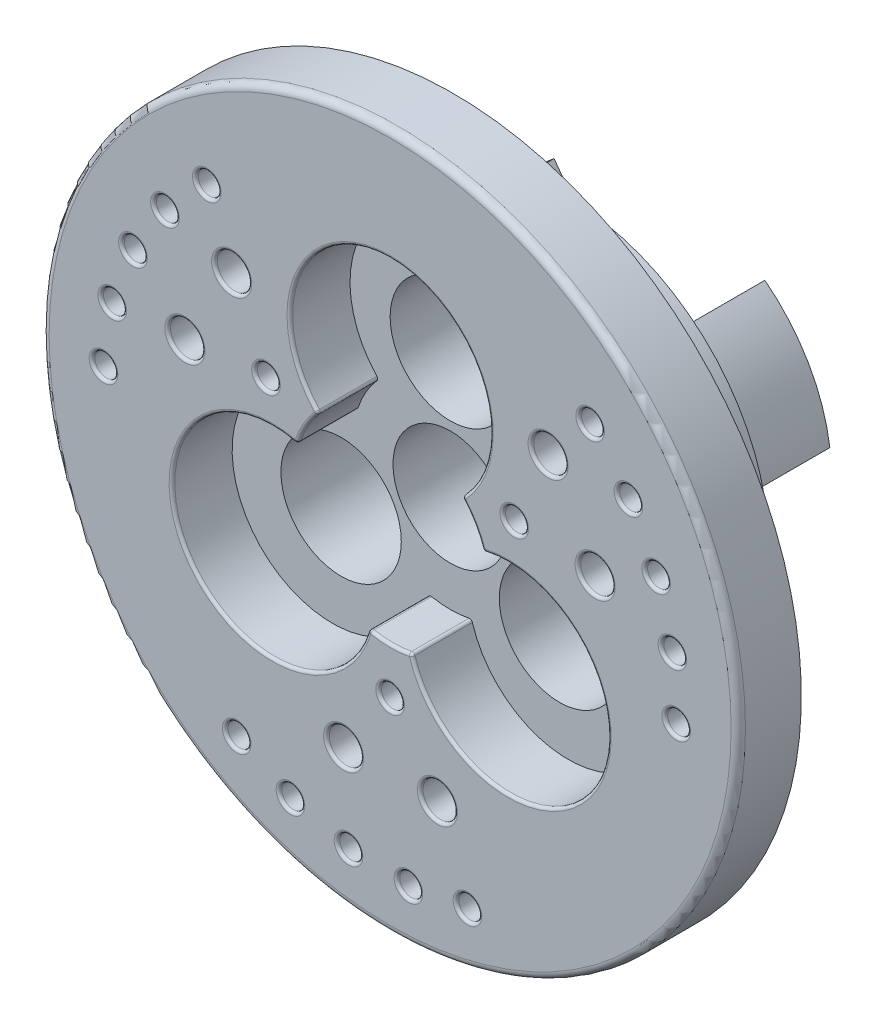
from build123d import *

# Parameters (mm, degrees)
ENL_V_MAT_EXTRU_1_DEPTH        = 183.67046833
ENL_V_MAT_EXTRU_1_DEPTH_BACK   = 42
ESQUISSE3_R                    = 21
BOSS_EXTRU_1_DEPTH             = 32
ENL_V_MAT_EXTRU_2_DEPTH        = 21
CONG_1_R                       = 2.5
CONG_2_R                       = 1
TROUS_DE_CENTRAGE_8_0MM1_D     = 8
TROUS_DE_CENTRAGE_8_0MM1_DEPTH = 22
TROUS_DE_CENTRAGE_8_0MM1_TIP   = 2.403442476
D_GAGEMENT_M121_D              = 13
D_GAGEMENT_M121_DEPTH          = 28
D_GAGEMENT_M121_TIP            = 3.905594024
ESQUISSE10_R                   = 4
ESQUISSE10_R_2                 = 6
ENL_V_MAT_EXTRU_3_DEPTH        = 21
CONG_3_R                       = 1


with BuildPart() as part:
    # Esquisse1 → Révolution1 (revolve)
    with BuildSketch(Plane(origin=(0, 0, 0), x_dir=(0, 0, -1), z_dir=(1, 0, 0)), mode=Mode.PRIVATE) as r_volution1_sk:
        Polygon((0, 20), (0, 70), (-40, 70), (-40, 121.5), (-62, 121.5), (-62, 20), align=None)
    revolve(r_volution1_sk.sketch.rotate(Axis((0, 0, 0), (0, 0, 1)), 90), axis=Axis((0, 0, 0), (0, 0, 1)))

    # Esquisse3 → Enlèv. mat.-Extru.1 (cut, two sides: drawn at the far end of the back side and taken through both)
    with BuildSketch(Plane(origin=(0, 0, 0), x_dir=(-1, 0, 0), z_dir=(0, 0, -1)).offset(-ENL_V_MAT_EXTRU_1_DEPTH_BACK)):
        with Locations((0, 44)):
            Circle(ESQUISSE3_R)
        with Locations((-38.105117767, -22)):
            Circle(ESQUISSE3_R)
        with Locations((38.105117767, -22)):
            Circle(ESQUISSE3_R)
    extrude(amount=ENL_V_MAT_EXTRU_1_DEPTH + ENL_V_MAT_EXTRU_1_DEPTH_BACK, mode=Mode.SUBTRACT)

    # Esquisse3<3> → Boss.-Extru.1 (add)
    with BuildSketch(Plane(origin=(0, 0, 0), x_dir=(-1, 0, 0), z_dir=(0, 0, -1))):
        with BuildLine():
            ThreePointArc((-17.954425256, 21.48577701), (-24.248711306, 14), (-27.584441339, 4.806099877))
            Line((-27.584441339, 4.806099877), (-59.443271559, 8.154597863))
            ThreePointArc((-59.443271559, 8.154597863), (-51.961524227, 30), (-36.783724687, 47.402084323))
            Line((-36.783724687, 47.402084323), (-17.954425256, 21.48577701))
        make_face()
        with BuildLine():
            Line((59.443271559, 8.154597863), (27.584441339, 4.806099877))
            ThreePointArc((27.584441339, 4.806099877), (24.248711306, 14), (17.954425256, 21.48577701))
            Line((17.954425256, 21.48577701), (36.783724687, 47.402084323))
            ThreePointArc((36.783724687, 47.402084323), (51.961524227, 30), (59.443271559, 8.154597863))
        make_face()
        with BuildLine():
            ThreePointArc((-9.630016083, -26.291876887), (0, -28), (9.630016083, -26.291876887))
            Line((9.630016083, -26.291876887), (22.659546872, -55.556682186))
            ThreePointArc((22.659546872, -55.556682186), (0, -60), (-22.659546872, -55.556682186))
            Line((-22.659546872, -55.556682186), (-9.630016083, -26.291876887))
        make_face()
    extrude(amount=BOSS_EXTRU_1_DEPTH)

    # Esquisse5 → Enlèv. mat.-Extru.2 (cut)
    with BuildSketch(Plane.XY.offset(62)):
        with BuildLine():
            ThreePointArc((25.018192688, 23.023684211), (0, 82.5), (-25.018192688, 23.023684211))
            ThreePointArc((-25.018192688, 23.023684211), (-29.444863729, 17), (-32.448191759, 10.154548319))
            ThreePointArc((-32.448191759, 10.154548319), (-71.447095812, -41.25), (-7.429999071, -33.17823253))
            ThreePointArc((-7.429999071, -33.17823253), (0, -34), (7.429999071, -33.17823253))
            ThreePointArc((7.429999071, -33.17823253), (71.447095812, -41.25), (32.448191759, 10.154548319))
            ThreePointArc((32.448191759, 10.154548319), (29.444863729, 17), (25.018192688, 23.023684211))
        make_face()
    extrude(amount=-ENL_V_MAT_EXTRU_2_DEPTH, mode=Mode.SUBTRACT)

    # Congé1
    cong_1_edges = [part.edges().sort_by_distance(p)[0] for p in [
        (121.5, 0, 62),
    ]]
    fillet(cong_1_edges, radius=CONG_1_R)

    # Congé2
    cong_2_edges = [part.edges().sort_by_distance(p)[0] for p in [
        (-32.448191759, 10.154548319, 51.5),
        (-25.018192688, 23.023684211, 51.5),
        (25.018192688, 23.023684211, 51.5),
        (32.448191759, 10.154548319, 51.5),
        (7.429999071, -33.17823253, 51.5),
        (-7.429999071, -33.17823253, 51.5),
        (-29.444863729, 17, 62),
        (-71.447095812, -41.25, 62),
        (0, -34, 62),
        (71.447095812, -41.25, 62),
        (29.444863729, 17, 62),
        (0, 82.5, 62),
    ]]
    fillet(cong_2_edges, radius=CONG_2_R)

    # Trous de centrage Ø8.0mm1
    with Locations(Plane(origin=(0, 0, -32), x_dir=(-1, 0, 0), z_dir=(0, 0, -1))):
        with Locations((-27.577599952, 23.140353949), (-33.828934348, 12.31272516), (33.828934348, 12.31272516), (27.577599952, 23.140353949), (6.251334396, -35.453079108), (-6.251334396, -35.453079108)):
            Hole(TROUS_DE_CENTRAGE_8_0MM1_D / 2, depth=TROUS_DE_CENTRAGE_8_0MM1_DEPTH)
            with Locations((0, 0, -(TROUS_DE_CENTRAGE_8_0MM1_DEPTH + TROUS_DE_CENTRAGE_8_0MM1_TIP / 2))):  # 118° drill point
                Cone(0, TROUS_DE_CENTRAGE_8_0MM1_D / 2, TROUS_DE_CENTRAGE_8_0MM1_TIP, mode=Mode.SUBTRACT)

    # Dégagement M121
    with Locations(Plane(origin=(43.301270189, 25, -32), x_dir=(-1, 0, 0), z_dir=(0, 0, -1))):
        with Locations((0, 0), (43.301270189, -75), (86.602540378, 0)):
            Hole(D_GAGEMENT_M121_D / 2, depth=D_GAGEMENT_M121_DEPTH)
            with Locations((0, 0, -(D_GAGEMENT_M121_DEPTH + D_GAGEMENT_M121_TIP / 2))):  # 118° drill point
                Cone(0, D_GAGEMENT_M121_D / 2, D_GAGEMENT_M121_TIP, mode=Mode.SUBTRACT)

    # Esquisse10 → Enlèv. mat.-Extru.3 (cut)
    with BuildSketch(Plane.XY.offset(62)):
        with Locations((-100.017363502, 0)):
            Circle(ESQUISSE10_R)
        with Locations((-96.998778394, 20.690285549)):
            Circle(ESQUISSE10_R)
        with Locations((-89.74440436, 40.300839584)):
            Circle(ESQUISSE10_R)
        with Locations((-78.571292357, 57.974586792)):
            Circle(ESQUISSE10_R)
        with Locations((-63.967760994, 72.93909961)):
            Circle(ESQUISSE10_R)
        with Locations((69.773716921, 67.566226205)):
            Circle(ESQUISSE10_R)
        with Locations((83.129767881, 51.478476986)):
            Circle(ESQUISSE10_R)
        with Locations((92.849125941, 32.965404548)):
            Circle(ESQUISSE10_R)
        with Locations((98.507008515, 12.836118993)):
            Circle(ESQUISSE10_R)
        with Locations((99.856138986, -8.029633309)):
            Circle(ESQUISSE10_R)
        with Locations((26.983224698, -100.300961718)):
            Circle(ESQUISSE10_R)
        with Locations((6.372799704, -103.823766534)):
            Circle(ESQUISSE10_R)
        with Locations((-14.519670359, -102.984441304)):
            Circle(ESQUISSE10_R)
        with Locations((-34.781084296, -97.819668567)):
            Circle(ESQUISSE10_R)
        with Locations((-53.525921095, -88.555173676)):
            Circle(ESQUISSE10_R)
        with Locations((0, -50)):
            Circle(ESQUISSE10_R)
        with Locations((43.301270189, 25)):
            Circle(ESQUISSE10_R)
        with Locations((-43.301270189, 25)):
            Circle(ESQUISSE10_R)
        with Locations((-71.60685005, 22.303789498)):
            Circle(ESQUISSE10_R_2)
        with Locations((-55.295800261, 50.669265571)):
            Circle(ESQUISSE10_R_2)
        with Locations((71.528771306, 22.552934963)):
            Circle(ESQUISSE10_R_2)
        with Locations((55.11907333, 50.861456479)):
            Circle(ESQUISSE10_R_2)
        with Locations((-16.232971045, -73.222200534)):
            Circle(ESQUISSE10_R_2)
        with Locations((16.487776719, -73.165245977)):
            Circle(ESQUISSE10_R_2)
    extrude(amount=-ENL_V_MAT_EXTRU_3_DEPTH, mode=Mode.SUBTRACT)

    # Congé3
    cong_3_edges = [part.edges().sort_by_distance(p)[0] for p in [
        (94.507008515, 12.836118993, 62),
        (95.856138986, -8.029633309, 62),
        (22.983224698, -100.300961718, 62),
        (2.372799704, -103.823766534, 62),
        (-18.519670359, -102.984441304, 62),
        (-38.781084296, -97.819668567, 62),
        (-57.525921095, -88.555173676, 62),
        (39.301270189, 25, 62),
        (-4, -50, 62),
        (-100.998778394, 20.690285549, 62),
        (-93.74440436, 40.300839584, 62),
        (-82.571292357, 57.974586792, 62),
        (-67.967760994, 72.93909961, 62),
        (65.773716921, 67.566226205, 62),
        (79.129767881, 51.478476986, 62),
        (88.849125941, 32.965404548, 62),
        (-22.232971045, -73.222200534, 62),
        (10.487776719, -73.165245977, 62),
        (65.528771306, 22.552934963, 62),
        (49.11907333, 50.861456479, 62),
        (-61.295800261, 50.669265571, 62),
        (-77.60685005, 22.303789498, 62),
        (-47.301270189, 25, 62),
        (-104.017363502, 0, 62),
    ]]
    fillet(cong_3_edges, radius=CONG_3_R)


solid = part.part
